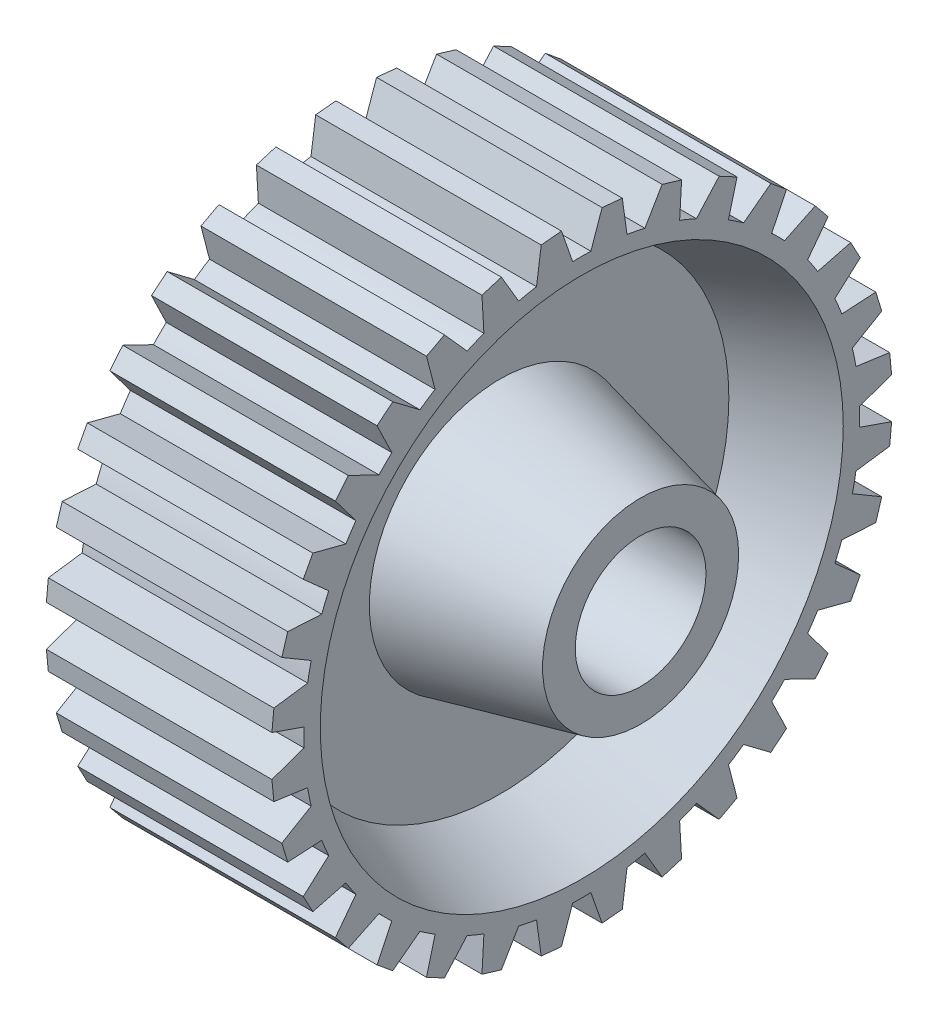
from build123d import *

# Parameters (mm, degrees)
BOSS_EXTRUDE1_DEPTH = 43.815
CIRPATTERN1_COUNT   = 32
CUT_EXTRUDE1_REACH  = 98.787


with BuildPart() as part:
    # Sketch1 → Revolve1 (revolve)
    with BuildSketch(Plane.XY, mode=Mode.PRIVATE) as revolve1_sk:
        Polygon((21.9075, 53.975), (-21.9075, 53.975), (-21.9075, 50.8), (-6.0325, 44.45), (-6.0325, 25.4), (-33.3375, 19.05), (-33.3375, 12.7), (-12.7127, 12.7), (-12.7127, 9.652), (12.7127, 9.652), (12.7127, 12.7), (33.3375, 12.7), (33.3375, 19.05), (6.0325, 25.4), (6.0325, 44.45), (21.9075, 50.8), align=None)
    revolve(revolve1_sk.sketch.rotate(Axis((0, 0, 0), (-1, 0, 0)), 90), axis=Axis((0, 0, 0), (-1, 0, 0)))

    # Sketch2 → Boss-Extrude1 (add)
    with BuildSketch(Plane.ZY.offset(21.9075)):
        with BuildLine():
            Line((60.195839544, 3.945443771), (53.946101109, 1.766012495))
            ThreePointArc((53.946101109, 1.766012495), (53.715095622, 5.290475149), (53.254073849, 8.792283176))
            Line((53.254073849, 8.792283176), (59.808911262, 7.873992546))
            Line((59.808911262, 7.873992546), (60.195839544, 3.945443771))
        make_face()
    boss_extrude1 = extrude(amount=-BOSS_EXTRUDE1_DEPTH)

    # CirPattern1: Boss-Extrude1 ×32 about axis
    cirpattern1_axis = Axis((0, 0, 0), (1, 0, 0))
    for i in range(1, CIRPATTERN1_COUNT):
        add(boss_extrude1.rotate(cirpattern1_axis, i * 360 / CIRPATTERN1_COUNT))

    # Sketch3 → Cut-Extrude1 (cut, up to next)
    with BuildSketch(Plane.ZY.offset(12.7127), mode=Mode.PRIVATE) as cut_extrude1_sk1:
        with BuildLine():
            Line((0, 11.8872), (-2.4384, 11.8872))
            Line((-2.4384, 11.8872), (-2.4384, 9.338913718))
            ThreePointArc((-2.4384, 9.338913718), (0, 9.652), (2.4384, 9.338913718))
            Line((2.4384, 9.338913718), (2.4384, 11.8872))
            Line((2.4384, 11.8872), (0, 11.8872))
        make_face()
    cut_extrude1_tool1 = extrude(cut_extrude1_sk1.sketch, amount=-CUT_EXTRUDE1_REACH, mode=Mode.PRIVATE) & part.part
    add(cut_extrude1_tool1.solids().sort_by_distance((-12.7127, 10.715908, 0))[0], mode=Mode.SUBTRACT)


solid = part.part
